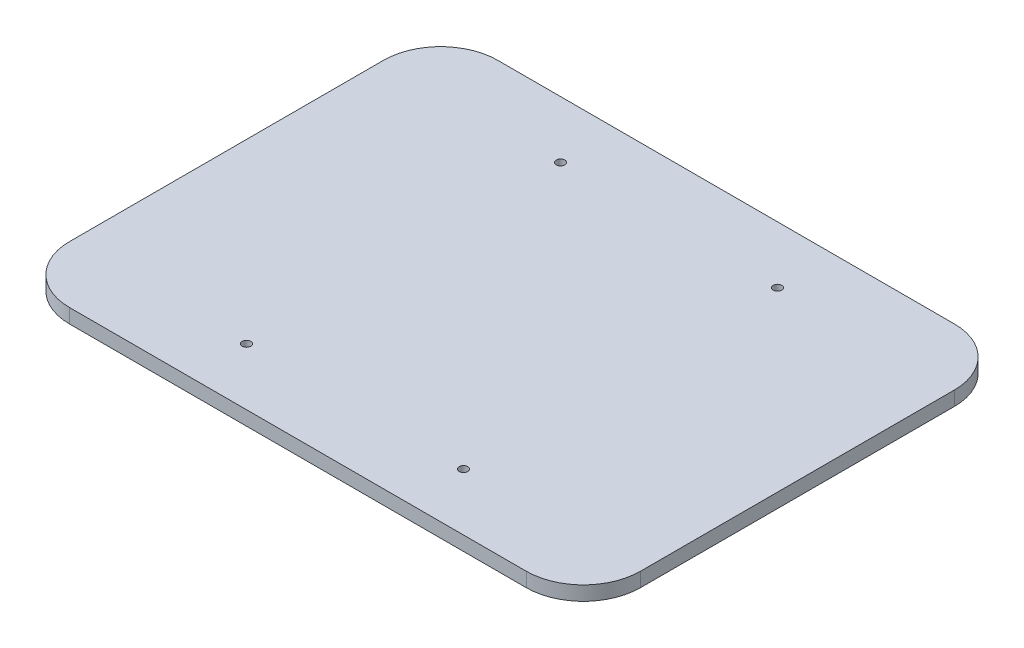
from build123d import *

# Parameters (mm, degrees)
RESSALTO_EXTRUS_O1_DEPTH = 5
ESBO_O2_R                = 1.5
CORTE_EXTRUS_O1_DEPTH    = 10


with BuildPart() as part:
    # Esboço1 → Ressalto-extrusão1 (new body)
    with BuildSketch(Plane(origin=(0, 0, 0), x_dir=(1, 0, 0), z_dir=(0, 1, 0))):
        with BuildLine():
            Line((-40.816022398, 183.1144834), (119.183977602, 183.1144834))
            ThreePointArc((119.183977602, 183.1144834), (133.326113225, 177.256619024), (139.183977602, 163.1144834))
            Line((139.183977602, 163.1144834), (139.183977602, 53.1144834))
            ThreePointArc((139.183977602, 53.1144834), (133.326113225, 38.972347776), (119.183977602, 33.1144834))
            Line((119.183977602, 33.1144834), (-40.816022398, 33.1144834))
            ThreePointArc((-40.816022398, 33.1144834), (-54.958158022, 38.972347776), (-60.816022398, 53.1144834))
            Line((-60.816022398, 53.1144834), (-60.816022398, 163.1144834))
            ThreePointArc((-60.816022398, 163.1144834), (-54.958158022, 177.256619024), (-40.816022398, 183.1144834))
        make_face()
    extrude(amount=RESSALTO_EXTRUS_O1_DEPTH)

    # Esboço2 → Corte-extrusão1 (cut)
    with BuildSketch(Plane(origin=(0, 5, 0), x_dir=(1, 0, 0), z_dir=(0, 1, 0))):
        with Locations(Location((1.183977602, 163.1144834, 0), (0, 0, 270))):
            Circle(ESBO_O2_R)
        with Locations(Location((77.183977602, 163.1144834, 0), (0, 0, 270))):
            Circle(ESBO_O2_R)
        with Locations(Location((77.183977602, 53.1144834, 0), (0, 0, 270))):
            Circle(ESBO_O2_R)
        with Locations(Location((1.183977602, 53.1144834, 0), (0, 0, 270))):
            Circle(ESBO_O2_R)
    extrude(amount=-CORTE_EXTRUS_O1_DEPTH, mode=Mode.SUBTRACT)


solid = part.part
